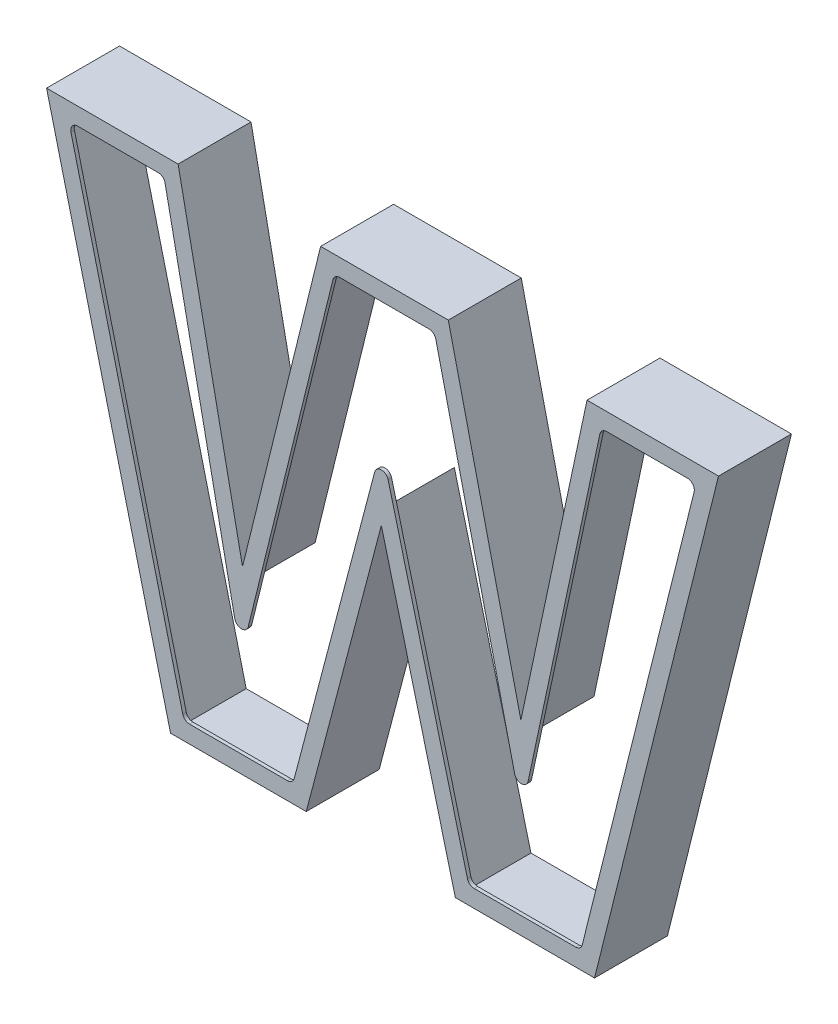
from build123d import *

# Parameters (mm, degrees)
BOSS_EXTRUDE1_DEPTH      = 1
BOSS_EXTRUDE1_DEPTH_BACK = 20
CUT_EXTRUDE1_DEPTH       = 20
CUT_EXTRUDE2_DEPTH       = 213.08892348854144
FILLET1_R                = 2


with BuildPart() as part:
    # Sketch1 → Boss-Extrude1 (new, two sides: drawn at the far end of the back side and taken through both)
    with BuildSketch(Plane.XY.offset(-BOSS_EXTRUDE1_DEPTH_BACK)):
        Polygon((2646.8216415771526, -1645.5825778387778), (2668.443454041995, -1563.4301992512205), (2689.750003141614, -1645.5825778387778), (2729.823511169442, -1645.5825778387778), (2765.5169447137464, -1502.5825778387775), (2727.659454154938, -1502.5825778387775), (2708.6195188972147, -1591.9057308997028), (2687.7252140876417, -1502.5825778387775), (2650.9700988373584, -1502.5825778387775), (2628.472349976695, -1593.6984607244628), (2609.9247872531955, -1502.5825778387775), (2572.055836643681, -1502.5825778387775), (2607.749270187985, -1645.5825778387778), align=None)
    extrude(amount=BOSS_EXTRUDE1_DEPTH + BOSS_EXTRUDE1_DEPTH_BACK)

    # 3DSketch1 → Cut-Extrude1 (cut)
    with BuildSketch(Plane(origin=(2690.52373407352, -1644.582577838785, -20), x_dir=(-0.6391782942740818, 0.7690585856284783, 0), z_dir=(0, 0, -1))):
        Polygon((0, 0), (79.56194930817296, 37.42380228418931), (28.42614813473769, -34.202308612791946), (52.4083937415845, -63.05771883529219), (183.34103881667534, -1.388e-14), (160.4765333052003, 27.510546630372875), (75.35406283201465, -18.178865153681013), (133.21853325786614, 60.30734081323959), (110.73293100318098, 87.3619914825534), (25.390706940818667, 44.69138476980368), (84.18362231643819, 119.30608903866502), (61.32155847684101, 146.81369785225445), (-24.620317595277953, 29.62313770222462), align=None)
    extrude(amount=-CUT_EXTRUDE1_DEPTH, mode=Mode.SUBTRACT)

    # 3DSketch2 → Cut-Extrude2 (cut, through all)
    with BuildSketch(Plane(origin=(2605.8400476167385, -1507.582577838778, 1), x_dir=(0.6701296542123282, -0.7422440613068356, 0), z_dir=(0, 0, 1))):
        Polygon((0, 0), (-18.350017001032523, -20.32471038743184), (102.61499812527803, -84.81138938300774), (123.59854919676319, -61.56974342682699), (68.74754201218234, 22.323071235087976), (157.54150984392544, -23.97409189109885), (179.1863444024586, 0), (102.71443922113765, 113.76780902490334), (84.34650287386148, 93.42325094344824), (148.62854454728856, 4.588347978661769), (52.21635833956266, 57.83549741007506), (32.86694064083099, 36.40383819852962), (95.66426345437596, -56.51066473506117), align=None)
    extrude(amount=-CUT_EXTRUDE2_DEPTH, mode=Mode.SUBTRACT)

    # Fillet1
    fillet1_edges = [part.edges().sort_by_distance(p)[0] for p in [
        (2611.6546507267108, -1640.5825778387798, 0.5),
        (2642.967324236363, -1640.5825778387775, 0.5),
        (2578.4572614861936, -1507.5825778387775, 0.5),
        (2605.8400476167385, -1507.582577838778, 0.5),
        (2654.885691895029, -1507.5825778387768, 0.5),
        (2683.7598322604117, -1507.5825778387764, 0.5),
        (2668.478981227683, -1543.650680619036, 0.5),
        (2693.618657801144, -1640.5825778387807, 0.5),
        (2725.918130630729, -1640.5825778387841, 0.5),
        (2759.115519871237, -1507.5825778387766, 0.5),
        (2731.7059936223714, -1507.582577838777, 0.5),
        (2708.8461168186655, -1614.826444325335, 0.5),
        (2628.0028021057956, -1616.4582814852965, 0.5),
    ]]
    fillet(fillet1_edges, radius=FILLET1_R)


solid = part.part
